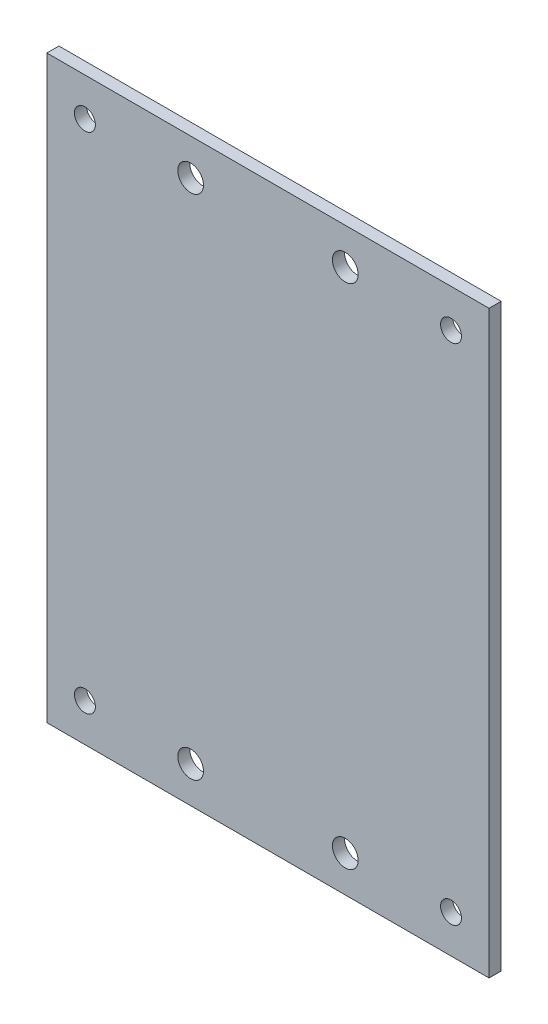
from build123d import *

# Parameters (mm, degrees)
SKETCH1_W               = 116.2
SKETCH1_H               = 152.4
BOSS_EXTRUDE1_DEPTH     = 3.175
M5_CLEARANCE_HOLE1_D    = 5.5
F_1_4_CLEARANCE_HOLE1_D = 6.7564


with BuildPart() as part:
    # Sketch1 → Boss-Extrude1 (new body)
    with BuildSketch(Plane.XY):
        with Locations((58.1, 76.2)):
            Rectangle(SKETCH1_W, SKETCH1_H)
    extrude(amount=BOSS_EXTRUDE1_DEPTH)

    # M5 Clearance Hole1 (through all)
    with Locations(Plane.XY.offset(3.175)):
        with Locations((10, 142.4), (106.2, 142.4), (106.2, 10), (10, 10)):
            Hole(M5_CLEARANCE_HOLE1_D / 2)

    # 1/4 Clearance Hole1 (through all)
    with Locations(Plane(origin=(0, 0, 0), x_dir=(-1, 0, 0), z_dir=(0, 0, -1))):
        with Locations((-78.42, 142.875), (-37.78, 142.875), (-37.78, 9.525), (-78.42, 9.525)):
            Hole(F_1_4_CLEARANCE_HOLE1_D / 2)


solid = part.part
